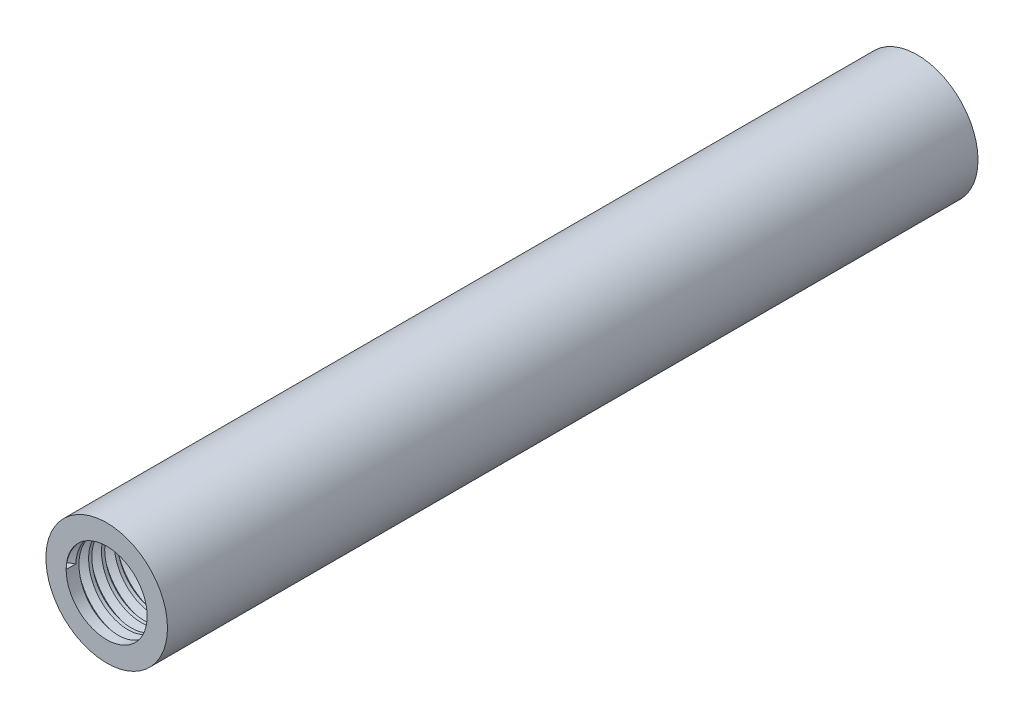
from build123d import *

# Parameters (mm, degrees)
THREAD1_PITCH  = 0.3175
THREAD1_HEIGHT = 4
THREAD1_RADIUS = 1
THREAD2_PITCH  = 0.3175
THREAD2_HEIGHT = 4
THREAD2_RADIUS = 1


with BuildPart() as part:
    # Sketch1 → Revolve1 (revolve)
    with BuildSketch(Plane(origin=(0, 0, 0), x_dir=(1, 0, 0), z_dir=(0, 1, 0))):
        Polygon((1, 20), (1, 15), (0, 15), (0, 5), (1, 5), (1, 0), (1.5, 0), (1.5, 20), align=None)
    revolve(axis=Axis((0, 0, 0), (0, 0, -1)))

    # Thread1: sweep along a helix
    with BuildLine() as thread1_path:
        Helix(THREAD1_PITCH, THREAD1_HEIGHT, THREAD1_RADIUS, center=(0, 0, 0), direction=(0, 0, -1))
    # Thread Profile1 → Thread1 (sweep, cut)
    with BuildSketch(Plane(origin=(-1, 0, 0), x_dir=(-1, 0, 0), z_dir=(0, -1, 0))):
        Polygon((0, 0), (0.171851915, 0.09921875), (0.171851915, 0.13890625), (0, 0.238124999), align=None)
    sweep(path=thread1_path.line, is_frenet=True, mode=Mode.SUBTRACT)

    # Thread2: sweep along a helix
    with BuildLine() as thread2_path:
        Helix(THREAD2_PITCH, THREAD2_HEIGHT, THREAD2_RADIUS, center=(0, 0, -20), direction=(0, 0, 1))
    # Thread Profile2 → Thread2 (sweep, cut)
    with BuildSketch(Plane(origin=(1, 0, -20), x_dir=(1, 0, 0), z_dir=(0, -1, 0))):
        Polygon((0, 0), (0.171851915, 0.09921875), (0.171851915, 0.13890625), (0, 0.238124999), align=None)
    sweep(path=thread2_path.line, is_frenet=True, mode=Mode.SUBTRACT)


solid = part.part
